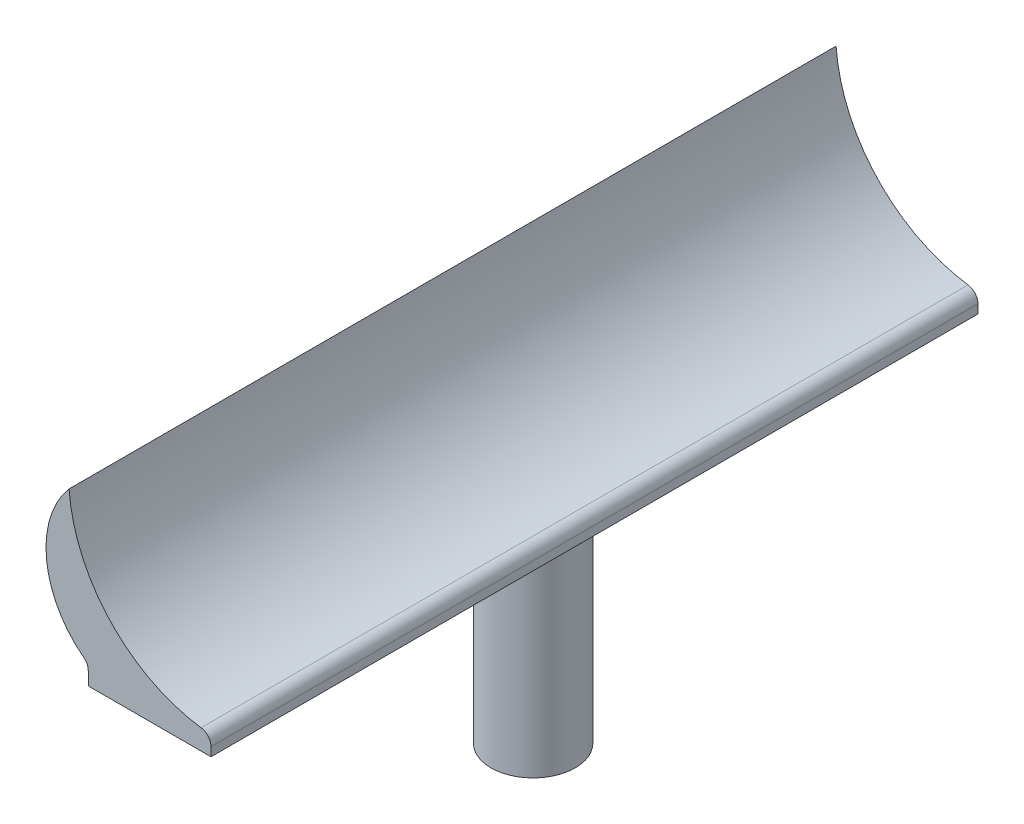
from build123d import *

# Parameters (mm, degrees)
SKETCH1_R           = 11
BOSS_EXTRUDE1_DEPTH = 55
BOSS_EXTRUDE2_DEPTH = 100
FILLET1_R           = 3


with BuildPart() as part:
    # Sketch1 → Boss-Extrude1 (new body)
    with BuildSketch(Plane(origin=(0, 0, 0), x_dir=(1, 0, 0), z_dir=(0, 1, 0))):
        with Locations(Location((0, 0, 0), (0, 0, 270))):
            Circle(SKETCH1_R)
    extrude(amount=BOSS_EXTRUDE1_DEPTH)

    # Sketch2 → Boss-Extrude2 (add, symmetric)
    with BuildSketch(Plane.XY):
        with BuildLine():
            Line((16, 55), (-16, 55))
            Line((-16, 55), (-16, 60))
            ThreePointArc((-16, 60), (-26.796302084, 77.378878097), (-21, 97))
            ThreePointArc((-21, 97), (-9.389178352, 71.610821648), (16, 60))
            Line((16, 60), (16, 55))
        make_face()
    extrude(amount=BOSS_EXTRUDE2_DEPTH, both=True)

    # Fillet1
    fillet1_edges = [part.edges().sort_by_distance(p)[0] for p in [
        (16, 60, 0),
        (-16, 60, 0),
    ]]
    fillet(fillet1_edges, radius=FILLET1_R)


solid = part.part
